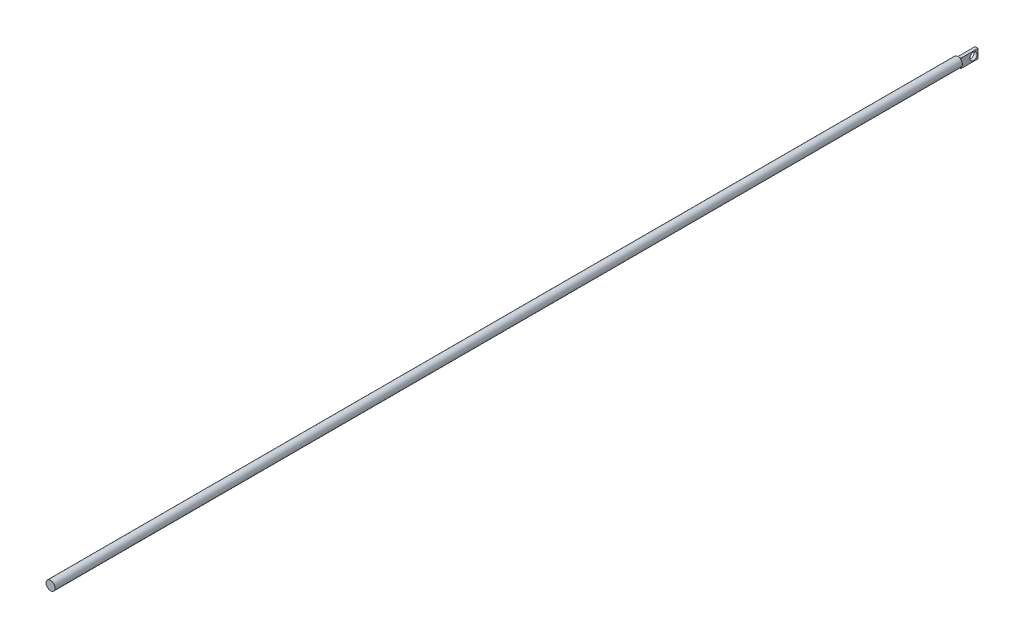
from build123d import *

# Parameters (mm, degrees)
SKETCH1_R           = 7.5
BOSS_EXTRUDE1_DEPTH = 1500
SKETCH4_W           = 28.313178599
SKETCH4_H           = 15
SKETCH4_R           = 6
BOSS_EXTRUDE3_DEPTH = 5


with BuildPart() as part:
    # Sketch1 → Boss-Extrude1 (new body)
    with BuildSketch(Plane.XY):
        Circle(SKETCH1_R)
    extrude(amount=BOSS_EXTRUDE1_DEPTH)


with BuildPart() as body_2:
    # Sketch4 → Boss-Extrude3 (new body)
    with BuildSketch(Plane(origin=(0, 0, 0), x_dir=(0, 0, -1), z_dir=(1, 0, 0))):
        with Locations((14.206629316, -0.084992358)):
            Rectangle(SKETCH4_W, SKETCH4_H)
        with Locations((21.073208184, -0.289020276)):
            Circle(SKETCH4_R, mode=Mode.SUBTRACT)
    extrude(amount=BOSS_EXTRUDE3_DEPTH)


solid = Compound([part.part, body_2.part])
